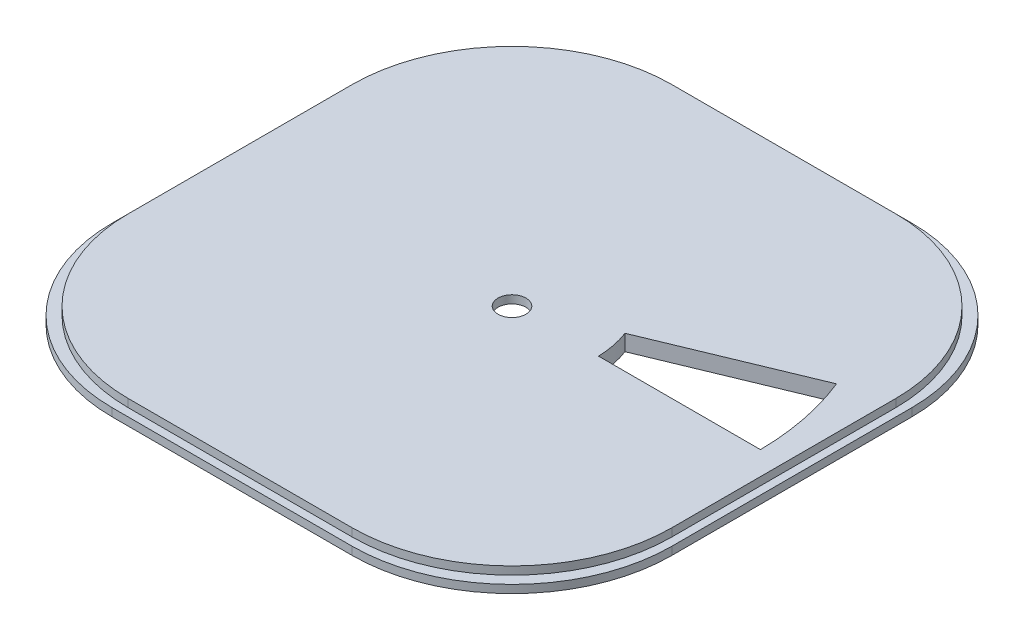
from build123d import *

# Parameters (mm, degrees)
BOSS_EXTRUDE5_DEPTH     = 2
BOSS_EXTRUDE6_DEPTH     = 2
SKETCH6_R               = 11
CUT_EXTRUDE1_DEPTH      = 2
CUT_EXTRUDE3_DEPTH      = 24
CUT_EXTRUDE3_DEPTH_BACK = 35
SKETCH7_R               = 2.603714659
SKETCH8_R               = 1.4
BOSS_EXTRUDE8_DEPTH     = 4
CUT_EXTRUDE8_DEPTH      = 4
CUT_EXTRUDE9_START      = -2
SKETCH17_R              = 1.4
CUT_EXTRUDE9_DEPTH      = 2
CUT_EXTRUDE10_DEPTH     = 1
SKETCH19_R              = 3.5
CUT_EXTRUDE11_DEPTH     = 10


with BuildPart() as part:
    # Sketch1 → Boss-Extrude5 (new body)
    with BuildSketch(Plane(origin=(0, 0, 0), x_dir=(1, 0, 0), z_dir=(0, 1, 0))):
        with BuildLine():
            Line((-30, 70), (30, 70))
            ThreePointArc((30, 70), (58.284271247, 58.284271247), (70, 30))
            Line((70, 30), (70, -30))
            ThreePointArc((70, -30), (58.284271247, -58.284271247), (30, -70))
            Line((30, -70), (-30, -70))
            ThreePointArc((-30, -70), (-58.284271247, -58.284271247), (-70, -30))
            Line((-70, -30), (-70, 30))
            ThreePointArc((-70, 30), (-58.284271247, 58.284271247), (-30, 70))
        make_face()
    extrude(amount=-BOSS_EXTRUDE5_DEPTH)

    # Sketch5 → Boss-Extrude6 (add)
    with BuildSketch(Plane(origin=(0, 0, 0), x_dir=(1, 0, 0), z_dir=(0, 1, 0))):
        with BuildLine():
            Line((-28, 68), (28, 68))
            ThreePointArc((28, 68), (56.284271247, 56.284271247), (68, 28))
            Line((68, 28), (68, -28))
            ThreePointArc((68, -28), (56.284271247, -56.284271247), (28, -68))
            Line((28, -68), (-28, -68))
            ThreePointArc((-28, -68), (-56.284271247, -56.284271247), (-68, -28))
            Line((-68, -28), (-68, 28))
            ThreePointArc((-68, 28), (-56.284271247, 56.284271247), (-28, 68))
        make_face()
    extrude(amount=BOSS_EXTRUDE6_DEPTH)

    # Sketch6 → Cut-Extrude1 (cut)
    with BuildSketch(Plane.XZ.offset(2)):
        with Locations(Location((0, 0, 0), (0, 0, 270))):
            Circle(SKETCH6_R)
    extrude(amount=-CUT_EXTRUDE1_DEPTH, mode=Mode.SUBTRACT)

    # Sketch7 → Cut-Extrude3 (cut, two sides: drawn at the far end of the back side and taken through both)
    with BuildSketch(Plane.XZ.offset(-CUT_EXTRUDE3_DEPTH_BACK)):
        with Locations(Location((0, 0, 0), (0, 0, 90))):
            Circle(SKETCH7_R)
    extrude(amount=CUT_EXTRUDE3_DEPTH + CUT_EXTRUDE3_DEPTH_BACK, mode=Mode.SUBTRACT)

    # Sketch8 → Boss-Extrude8 (add)
    with BuildSketch(Plane(origin=(0, 0, 0), x_dir=(1, 0, 0), z_dir=(0, 1, 0))):
        with Locations(Location((13, 13, 0), (0, 0, 270))):
            Circle(SKETCH8_R)
        with Locations(Location((13, -13, 0), (0, 0, 270))):
            Circle(SKETCH8_R)
        with Locations(Location((-13, -13, 0), (0, 0, 270))):
            Circle(SKETCH8_R)
        with Locations(Location((-13, 13, 0), (0, 0, 270))):
            Circle(SKETCH8_R)
    extrude(amount=-BOSS_EXTRUDE8_DEPTH)

    # Sketch15 → Cut-Extrude8 (cut)
    with BuildSketch(Plane(origin=(0, 2, 0), x_dir=(1, 0, 0), z_dir=(0, 1, 0))):
        with BuildLine():
            Line((20.002895237, 8.260924079), (57.425217049, 23.761757309))
            ThreePointArc((57.425217049, 23.761757309), (60.897596895, 12.098982138), (62.152687059, -0.004839374))
            Line((62.152687059, -0.004839374), (21.647057814, -0.004839374))
            ThreePointArc((21.647057814, -0.004839374), (21.175793038, 4.197824096), (20.002895237, 8.260924079))
        make_face()
    extrude(amount=-CUT_EXTRUDE8_DEPTH, mode=Mode.SUBTRACT)

    # Sketch17 → Cut-Extrude9 (cut)
    with BuildSketch(Plane.XZ.offset(4).offset(CUT_EXTRUDE9_START)):
        with Locations((13, 13)):
            Circle(SKETCH17_R)
        with Locations((13, -13)):
            Circle(SKETCH17_R)
        with Locations((-13, -13)):
            Circle(SKETCH17_R)
        with Locations((-13, 13)):
            Circle(SKETCH17_R)
    extrude(amount=CUT_EXTRUDE9_DEPTH, mode=Mode.SUBTRACT)

    # Sketch18 → Cut-Extrude10 (cut)
    with BuildSketch(Plane.XZ.offset(2)):
        with BuildLine():
            Line((-70, 0), (-70, 4))
            Line((-70, 4), (-10.246950766, 4))
            ThreePointArc((-10.246950766, 4), (-11, 0), (-10.246950766, -4))
            Line((-10.246950766, -4), (-70, -4))
            Line((-70, -4), (-70, 0))
        make_face()
    extrude(amount=-CUT_EXTRUDE10_DEPTH, mode=Mode.SUBTRACT)

    # Sketch19 → Cut-Extrude11 (cut)
    with BuildSketch(Plane.XZ):
        with Locations(Location((0, 0, 0), (0, 0, 270))):
            Circle(SKETCH19_R)
    extrude(amount=-CUT_EXTRUDE11_DEPTH, mode=Mode.SUBTRACT)


solid = part.part
